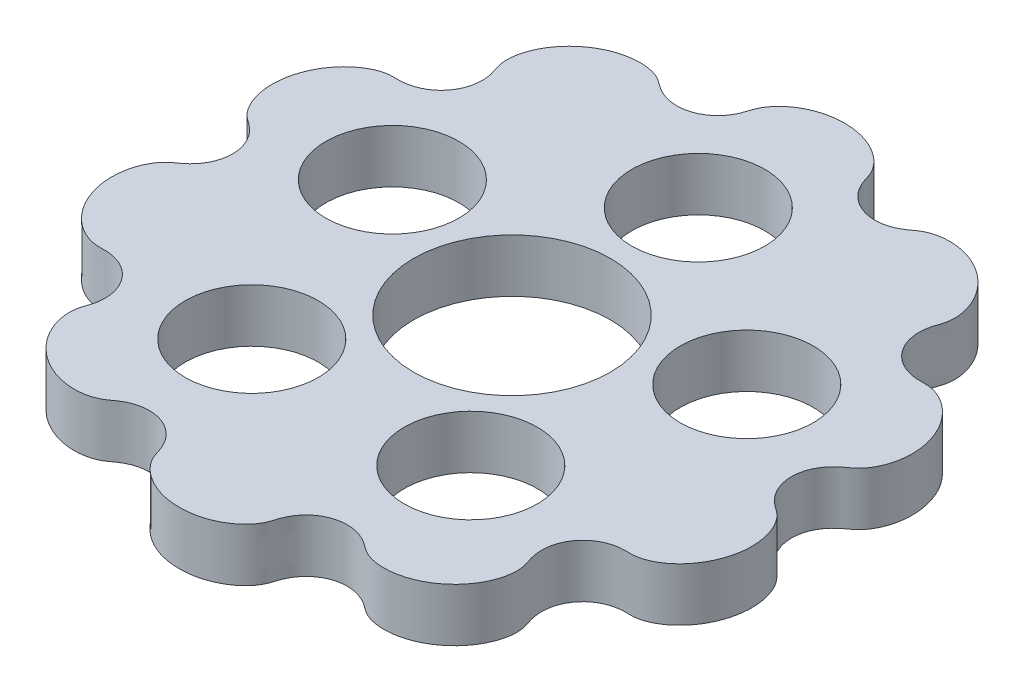
from build123d import *

# Parameters (mm, degrees)
BOSS_EXTRUDE1_DEPTH = 10
SKETCH2_R           = 18.5
CUT_EXTRUDE1_DEPTH  = 10
SKETCH3_R           = 12.5
CUT_EXTRUDE2_DEPTH  = 10


with BuildPart() as part:
    # Sketch1 → Boss-Extrude1 (new body)
    with BuildSketch(Plane(origin=(0, 0, 0), x_dir=(1, 0, 0), z_dir=(0, 1, 0))):
        with BuildLine():
            Line((52.500112047, 0.041499268), (52.5, 0))
            add(Edge.make_bspline(
                [(52.5, 0), (52.5, -0.040775104), (52.500774613, -0.123087013), (52.504260374, -0.275203234), (52.513552623, -0.474859373), (52.530965766, -0.708851543), (52.561121002, -0.98870434), (52.609439336, -1.315624541), (52.682361725, -1.681556002), (52.79478949, -2.132352063), (53.017440279, -2.830912765), (53.427825855, -3.753064751), (54.070723482, -4.744647846), (54.830098124, -5.57543267), (55.503742099, -6.156986939), (56.012379262, -6.538989783), (56.410817284, -6.8180386), (56.792354666, -7.089426209), (57.141972837, -7.372775575), (57.520705307, -7.729900694), (57.915655074, -8.169788958), (58.493265667, -8.937596576), (59.088332831, -9.999121058), (59.60031922, -11.302344039), (60.049283036, -13.196982519), (60.21435633, -15.393229318), (59.936875398, -17.972579969), (59.123851439, -20.445560196), (58.061489591, -22.416056329), (56.93724145, -23.918460352), (55.904987118, -25.008602876), (54.669536216, -26.028627864), (53.297351575, -26.859933117), (52.038099601, -27.360838699), (50.961670842, -27.590008876), (50.217402108, -27.645168686), (49.722891169, -27.643633637), (49.243636807, -27.633529208), (48.778988932, -27.638419544), (48.221278005, -27.666683373), (47.41280666, -27.758419009), (46.36184117, -27.997640241), (45.106586398, -28.507483026), (43.830924892, -29.341955818), (42.742085128, -30.41036414), (41.886481884, -31.671659022), (41.301364772, -33.057237307), (40.99581945, -34.504112382), (40.966298719, -35.851798689), (41.119084615, -36.941869369), (41.33280208, -37.775207751), (41.516924768, -38.34844275), (41.666645545, -38.77904393), (41.800656721, -39.192740913), (41.903341656, -39.593554607), (41.993133909, -40.078929424), (42.052216808, -40.649589301), (42.065252977, -41.370183161), (41.996014835, -42.235021446), (41.811794729, -43.268256263), (41.463289857, -44.44971281), (40.795122932, -46.026243031), (39.631588245, -47.891122448), (37.881243888, -49.810401445), (35.757139486, -51.328799151), (33.722804169, -52.293622479), (31.909539427, -52.841120104), (30.417481353, -53.106645377), (28.866576826, -53.18693875), (27.506439201, -53.066248838), (26.359550674, -52.806209521), (25.481229259, -52.483830009), (24.949497308, -52.22752035), (24.545269464, -51.987858636), (24.197836887, -51.752478957), (23.91719106, -51.543602368), (23.638072028, -51.333216659), (23.232003211, -51.041007331), (22.747291626, -50.720207013), (21.966309113, -50.282205151), (20.8507479, -49.837358278), (19.511516152, -49.545007241), (17.973118181, -49.515911952), (16.464788325, -49.789598147), (15.048825761, -50.353729824), (13.794685705, -51.165870404), (12.736744373, -52.179362518), (11.958645939, -53.262101177), (11.470580022, -54.23549557), (11.172776949, -55.033617241), (10.994183181, -55.601171139), (10.863038629, -56.033024877), (10.719891261, -56.439711402), (10.557601138, -56.816955145), (10.335220959, -57.252767932), (10.039175881, -57.737601345), (9.618795925, -58.314311024), (9.049448054, -58.957537258), (8.02602458, -59.914761677), (6.414925386, -61.01402137), (4.18541385, -61.99047672), (1.339206638, -62.560334562), (-1.555531464, -62.53729671), (-4.027053866, -62.002092903), (-6.020498101, -61.177979995), (-7.433612118, -60.318248685), (-8.349845643, -59.613363928), (-9.059073439, -58.943021869), (-9.588949014, -58.348313406), (-10.039829693, -57.741557787), (-10.365276791, -57.206581724), (-10.601994867, -56.725204004), (-10.784693807, -56.266063365), (-10.903590116, -55.900984278), (-11.008873941, -55.553724102), (-11.134049094, -55.16276416), (-11.269248876, -54.774995851), (-11.523977597, -54.135327447), (-11.97036594, -53.259233437), (-12.664097567, -52.265735325), (-13.688242337, -51.253082849), (-14.898427531, -50.438148562), (-16.281880822, -49.846825376), (-17.790043805, -49.530016792), (-19.353945001, -49.522503129), (-20.901974601, -49.835627594), (-22.114833491, -50.341973603), (-22.958543667, -50.848586676), (-23.503901488, -51.235222612), (-23.850472854, -51.492291991), (-24.137313704, -51.709093473), (-24.432197812, -51.915271617), (-24.84493276, -52.167528227), (-25.321855844, -52.412656958), (-25.96481748, -52.671655444), (-26.781628931, -52.905200029), (-27.808201786, -53.093827833), (-29.044525926, -53.179007384), (-30.44463053, -53.105993185), (-31.982839615, -52.825723181), (-33.849256231, -52.246902431), (-35.958134282, -51.21612146), (-37.845089492, -49.811408736), (-39.434207075, -48.089368266), (-40.517522955, -46.475169127), (-41.221930423, -45.088252289), (-41.676779129, -43.804668375), (-41.933312299, -42.66675977), (-42.045425372, -41.702444398), (-42.067377697, -40.925961222), (-42.021074543, -40.264759033), (-41.932238905, -39.723786783), (-41.810407763, -39.224890497), (-41.689047079, -38.844186817), (-41.557634437, -38.467204533), (-41.40843966, -38.011933626), (-41.263776073, -37.51715494), (-41.122558611, -36.901278864), (-41.018323259, -36.161630315), (-40.983791966, -35.380565994), (-41.035800805, -34.417307382), (-41.250683665, -33.265400151), (-41.724972968, -31.974622959), (-42.561003579, -30.626764416), (-43.666232311, -29.470591914), (-44.9678346, -28.575717503), (-46.406824522, -27.966624741), (-47.678381182, -27.698584729), (-48.721400157, -27.629657861), (-49.455398293, -27.637667477), (-49.883858288, -27.645357105), (-50.312272667, -27.637708005), (-50.984181143, -27.586491548), (-52.020178925, -27.367063728), (-53.299737285, -26.858300232), (-54.683978708, -26.018809413), (-55.929162606, -24.989246611), (-56.988984387, -23.860138009), (-58.136648947, -22.301668216), (-59.199039353, -20.273838696), (-59.986881871, -17.748693553), (-60.21964241, -15.133491801), (-60.009115811, -12.931924961), (-59.531985693, -11.105818685), (-59.020540349, -9.869815751), (-58.444529768, -8.870463614), (-57.911905451, -8.16589022), (-57.533893822, -7.745175041), (-57.186010877, -7.413925705), (-56.882639117, -7.160406886), (-56.540492932, -6.908118175), (-56.167029965, -6.648675798), (-55.670549933, -6.288310206), (-54.992871461, -5.730778683), (-54.210261673, -4.921559825), (-53.431761371, -3.793482861), (-52.830005835, -2.428848247), (-52.50018024, -0.966894579), (-52.45710778, 0.55217178), (-52.715346679, 2.061038448), (-53.262745959, 3.483189007), (-54.003522836, 4.655570316), (-54.738842919, 5.480176022), (-55.363609549, 6.038854723), (-55.822698494, 6.398885917), (-56.199652301, 6.671642922), (-56.580876946, 6.936217924), (-56.952359332, 7.21299597), (-57.356964995, 7.565455772), (-57.779033807, 8.005594079), (-58.333004427, 8.703310537), (-58.930858079, 9.690000179), (-59.468395563, 10.920525875), (-59.88098257, 12.393861768), (-60.104110317, 13.886861601), (-60.162929299, 15.77263982), (-59.894351202, 18.031901967), (-59.222128747, 20.215221461), (-58.171721151, 22.239421873), (-57.055582562, 23.777128021), (-56.02560654, 24.895455314), (-54.800789785, 25.934015099), (-53.599166224, 26.686592588), (-52.479058719, 27.188073207), (-51.541410433, 27.463768014), (-50.907996169, 27.58623828), (-50.323052413, 27.642444042), (-49.793368704, 27.645454859), (-49.161420973, 27.630897707), (-48.425638713, 27.643923436), (-47.452112168, 27.743202219), (-46.253392235, 28.031088734), (-44.966985481, 28.579010116), (-43.681931524, 29.459496211), (-42.581632308, 30.601244304), (-41.741453991, 31.940574772), (-41.260247486, 33.231303487), (-41.039889407, 34.384774707), (-40.983925413, 35.349776914), (-41.015606549, 36.13235386), (-41.117442143, 36.873430873), (-41.256894642, 37.490405082), (-41.40044371, 37.986071754), (-41.549005454, 38.442040607), (-41.680489719, 38.81941179), (-41.803238659, 39.200044109), (-41.927309345, 39.698951407), (-42.018383692, 40.240195152), (-42.066935039, 40.902074767), (-42.047115021, 41.679637388), (-41.959147144, 42.452360499), (-41.80983027, 43.215616682), (-41.552975722, 44.153132728), (-41.141175226, 45.245572709), (-40.525557083, 46.461715744), (-39.4424436, 48.079451974), (-37.85404638, 49.803595139), (-35.968278488, 51.209686131), (-33.861529251, 52.241649801), (-31.998674239, 52.821691844), (-30.46337711, 53.103608918), (-28.837187897, 53.191254625), (-27.407614237, 53.056444511), (-26.201202795, 52.76438447), (-25.279351434, 52.396703468), (-24.677788171, 52.080354109), (-24.21752736, 51.769607541), (-23.873955873, 51.509928533), (-23.528223416, 51.252981421), (-22.984627988, 50.865507158), (-22.144104002, 50.356693714), (-20.935439425, 49.846213318), (-19.3913041, 49.526456256), (-17.829254478, 49.526135593), (-16.319695021, 49.835022896), (-14.932096914, 50.419729412), (-13.715938616, 51.230198589), (-12.686115318, 52.239564641), (-11.987509156, 53.231250656), (-11.537238791, 54.106589689), (-11.280154609, 54.74590305), (-11.143490652, 55.134555258), (-11.017251726, 55.52655965), (-10.911617075, 55.874694641), (-10.793605506, 56.240873359), (-10.61264544, 56.701454513), (-10.377657722, 57.184306701), (-10.05367296, 57.721089897), (-9.603957867, 58.330025828), (-9.074733276, 58.927008479), (-8.365866072, 59.599921208), (-7.44951617, 60.307550778), (-6.035632673, 61.170720627), (-4.04018557, 61.998420975), (-1.579089164, 62.533605592), (1.291815666, 62.561795887), (3.752258944, 62.079889071), (5.745965785, 61.307921444), (7.199793361, 60.474219704), (8.183788526, 59.75526832), (9.08534121, 58.934715248), (9.77298311, 58.141310376), (10.26637145, 57.40134047), (10.590569673, 56.751733025), (10.782976111, 56.272926309), (10.929805218, 55.818826792), (11.082053727, 55.310602543), (11.272919801, 54.75795526), (11.507073298, 54.188205456), (11.795151363, 53.608443196), (12.233667119, 52.879331142), (12.884248795, 52.038068903), (13.796070035, 51.167665373), (15.032902903, 50.363317809), (16.441314941, 49.796050701), (17.946742147, 49.517551845), (19.490594486, 49.54245585), (20.988089237, 49.865761077), (22.166965774, 50.368484275), (23.002510374, 50.877366694), (23.541879966, 51.263001962), (23.883796536, 51.517387838), (24.223900371, 51.774078316), (24.677797346, 52.079837114), (25.268883718, 52.391266914), (26.172078382, 52.754113463), (27.352445592, 53.045797013), (28.752366956, 53.187326819), (30.346839996, 53.115359385), (31.854236365, 52.854985782), (33.686501376, 52.309236301), (35.734839756, 51.343386182), (37.867854874, 49.822880178), (39.622725085, 47.902057151), (40.786724772, 46.041502486), (41.456361051, 44.468438722), (41.80657843, 43.289417372), (41.99284709, 42.258198954), (42.064280359, 41.394940087), (42.053563066, 40.675459718), (41.996733194, 40.105472702), (41.909150659, 39.620367743), (41.808437593, 39.21948535), (41.675961045, 38.805916273), (41.526336774, 38.376128681), (41.341357817, 37.804547222), (41.125224382, 36.973353631), (40.968386981, 35.885816058), (40.991909962, 34.540385624), (41.290083968, 33.094121724), (41.86974643, 31.701518261), (42.727245107, 30.42570814), (43.826776707, 29.342697928), (45.124572371, 28.495874409), (46.306742469, 28.021705499), (47.276769412, 27.789943287), (48.00922742, 27.689721552), (48.479227355, 27.650650673), (48.950392436, 27.634492295), (49.421529354, 27.636348205), (49.892283913, 27.646657347), (50.363277789, 27.63803436), (50.905300024, 27.585271394), (51.51251131, 27.470335592), (52.377287443, 27.221336204), (53.447566574, 26.760818113), (54.611545034, 26.064224331), (56.112483168, 24.854029299), (57.637143252, 23.134068615), (58.989135241, 20.848764181), (59.932831288, 17.996368795), (60.213669841, 15.407261933), (60.051536889, 13.214223886), (59.606259706, 11.321795444), (59.097629324, 10.019537514), (58.506049745, 8.958102514), (57.931698947, 8.18961796), (57.539001836, 7.748957275), (57.162482014, 7.390873577), (56.814939151, 7.106469911), (56.434736206, 6.834545529), (56.036508617, 6.556332642), (55.52738295, 6.176006208), (54.85281643, 5.59762287), (54.214751532, 4.905088715), (53.646797062, 4.091977331), (53.263477344, 3.366666269), (53.046152845, 2.864253535), (52.891115189, 2.433101978), (52.782934872, 2.08053528), (52.691189954, 1.720373118), (52.616465578, 1.355469061), (52.566473841, 1.029116993), (52.534855461, 0.749611282), (52.516206484, 0.515950905), (52.505852491, 0.316761484), (52.501548502, 0.164275854), (52.500332064, 0.082243276), (52.500112047, 0.041499268)],
                knots=[0.06845127, 0.06845127, 0.06845127, 0.06845127, 0.06845127, 0.068823272, 0.069195273, 0.069567274, 0.069939276, 0.070683278, 0.071427281, 0.072154812, 0.072882343, 0.074337405, 0.07719601, 0.080073521, 0.082134054, 0.08316432, 0.084194587, 0.085079604, 0.085964622, 0.08684964, 0.087734657, 0.089174128, 0.090613599, 0.094403019, 0.097278761, 0.100154504, 0.105904344, 0.111655069, 0.117552368, 0.1205004, 0.123448432, 0.126396991, 0.129345549, 0.133079313, 0.136027875, 0.13700093, 0.137973986, 0.138947041, 0.139920097, 0.140775668, 0.141631239, 0.143342381, 0.146320718, 0.149231392, 0.152233675, 0.15526906, 0.158251886, 0.16115228, 0.164001532, 0.166843446, 0.168806033, 0.169787326, 0.17076862, 0.171582383, 0.172396147, 0.17320991, 0.174023674, 0.175465733, 0.176907793, 0.178875994, 0.180844196, 0.183714604, 0.186585013, 0.192323159, 0.198062711, 0.204015066, 0.206990805, 0.209966544, 0.212942593, 0.215918641, 0.219183194, 0.220677276, 0.222171358, 0.223272511, 0.223823088, 0.224373664, 0.225474818, 0.226025394, 0.226575971, 0.228312193, 0.230048414, 0.233063602, 0.235996078, 0.239037647, 0.242085279, 0.245051887, 0.247917801, 0.250729216, 0.253554306, 0.255492533, 0.256461646, 0.25743076, 0.258238474, 0.259046189, 0.259853904, 0.260661618, 0.26208787, 0.263514123, 0.265464894, 0.267415665, 0.273101354, 0.278785369, 0.284470299, 0.290103678, 0.295735944, 0.298553065, 0.301370187, 0.303094953, 0.304819719, 0.306226752, 0.307633785, 0.309039221, 0.30974194, 0.310444658, 0.311522042, 0.312060734, 0.312599426, 0.31367681, 0.314754194, 0.317479171, 0.320323626, 0.323166882, 0.326028942, 0.328898819, 0.332098663, 0.335219163, 0.338253411, 0.341251382, 0.342383822, 0.342950043, 0.343516263, 0.344648704, 0.345214925, 0.345781145, 0.347323091, 0.348865036, 0.350661989, 0.352458943, 0.355528451, 0.358597959, 0.361667797, 0.364737635, 0.370878007, 0.376986352, 0.380040162, 0.383093972, 0.386147981, 0.38920199, 0.390729266, 0.392256542, 0.393782993, 0.395309444, 0.39593816, 0.396566876, 0.397824309, 0.398453025, 0.399081741, 0.400339174, 0.401881099, 0.403423024, 0.404954093, 0.406485162, 0.409463946, 0.412614603, 0.415707767, 0.418884467, 0.4219674, 0.424963071, 0.427931545, 0.429055978, 0.430180411, 0.430742628, 0.431304844, 0.432429277, 0.435479881, 0.439041038, 0.442082184, 0.44512333, 0.44816352, 0.451203711, 0.45728559, 0.46305952, 0.468832192, 0.471719554, 0.474606917, 0.477880013, 0.479326404, 0.480772795, 0.481550431, 0.482328068, 0.483105704, 0.483883341, 0.484896159, 0.485908976, 0.487934612, 0.49078543, 0.493726769, 0.49663789, 0.499605508, 0.502511284, 0.505616872, 0.508611335, 0.511523531, 0.513363684, 0.51428376, 0.515203837, 0.516115167, 0.517026498, 0.517937828, 0.518849159, 0.520335083, 0.521821008, 0.524940044, 0.527904552, 0.530869061, 0.533833005, 0.53679695, 0.542726335, 0.548697614, 0.551682524, 0.554667433, 0.557653568, 0.560639704, 0.564291067, 0.565785387, 0.567279707, 0.568321479, 0.569363251, 0.570405024, 0.571446796, 0.573299705, 0.575152614, 0.578095141, 0.581116502, 0.58423972, 0.587334492, 0.590491619, 0.593476477, 0.595011269, 0.596546061, 0.598089729, 0.599633398, 0.600892048, 0.601521373, 0.602150698, 0.603409348, 0.604038673, 0.604667998, 0.606196302, 0.607724606, 0.609254007, 0.610783408, 0.612312631, 0.613841854, 0.616900299, 0.619958524, 0.623016749, 0.629133832, 0.635264708, 0.638329743, 0.641394778, 0.644459353, 0.647523928, 0.651113076, 0.652652789, 0.654192502, 0.655322957, 0.656453413, 0.657018641, 0.657583869, 0.658714324, 0.661708929, 0.664737241, 0.667851628, 0.671047845, 0.673919086, 0.676787714, 0.679636085, 0.682486592, 0.685207159, 0.686287989, 0.68736882, 0.687909236, 0.688449651, 0.689530482, 0.690233726, 0.69093697, 0.692343457, 0.693752743, 0.69516203, 0.696889481, 0.698616933, 0.701438229, 0.704259526, 0.709899918, 0.715541538, 0.721126111, 0.726710151, 0.729502368, 0.732294586, 0.734290209, 0.736285833, 0.739083712, 0.740538691, 0.741266181, 0.74199367, 0.743143851, 0.744294032, 0.745444213, 0.746594394, 0.74799041, 0.749386427, 0.752134605, 0.754942324, 0.757860682, 0.760934045, 0.764010929, 0.766913817, 0.769939, 0.772922153, 0.774040585, 0.774599801, 0.775159017, 0.776277448, 0.77739588, 0.778902389, 0.780408899, 0.783926778, 0.786931093, 0.789935409, 0.792938496, 0.795941582, 0.801949213, 0.807679923, 0.813409325, 0.816275311, 0.819141297, 0.821106721, 0.823072145, 0.824511541, 0.825950937, 0.82676387, 0.827576803, 0.828389735, 0.829202668, 0.830181625, 0.831160582, 0.833118497, 0.835958323, 0.838801693, 0.841696397, 0.844676707, 0.84776064, 0.850823682, 0.853764411, 0.85679873, 0.857726636, 0.858654542, 0.859582448, 0.860510354, 0.861436959, 0.862363564, 0.863290169, 0.864216774, 0.865719604, 0.867222434, 0.870363348, 0.873362207, 0.876361065, 0.882358431, 0.888356938, 0.894098863, 0.899840077, 0.902711294, 0.905582512, 0.909366312, 0.910804045, 0.912241777, 0.913124921, 0.914008066, 0.91489121, 0.915774354, 0.916803936, 0.917833519, 0.919892684, 0.922762104, 0.92418929, 0.925616475, 0.92634252, 0.927068565, 0.927794611, 0.928520656, 0.929264102, 0.930007548, 0.930379271, 0.930750994, 0.931122717, 0.93149444, 0.93149444, 0.93149444, 0.93149444, 0.93149444], degree=4))
        make_face()
    extrude(amount=BOSS_EXTRUDE1_DEPTH)

    # Sketch2 → Cut-Extrude1 (cut)
    with BuildSketch(Plane(origin=(0, 10, 0), x_dir=(1, 0, 0), z_dir=(0, 1, 0))):
        with Locations(Location((0, 0, 0), (0, 0, 270))):
            Circle(SKETCH2_R)
    extrude(amount=-CUT_EXTRUDE1_DEPTH, mode=Mode.SUBTRACT)

    # Sketch3 → Cut-Extrude2 (cut)
    with BuildSketch(Plane(origin=(0, 10, 0), x_dir=(1, 0, 0), z_dir=(0, 1, 0))):
        with Locations(Location((0, 35, 0), (0, 0, 270))):
            Circle(SKETCH3_R)
        with Locations(Location((33.28697807, 10.815594803, 0), (0, 0, 270))):
            Circle(SKETCH3_R)
        with Locations(Location((20.57248383, -28.315594803, 0), (0, 0, 270))):
            Circle(SKETCH3_R)
        with Locations(Location((-20.57248383, -28.315594803, 0), (0, 0, 270))):
            Circle(SKETCH3_R)
        with Locations(Location((-33.28697807, 10.815594803, 0), (0, 0, 270))):
            Circle(SKETCH3_R)
    extrude(amount=-CUT_EXTRUDE2_DEPTH, mode=Mode.SUBTRACT)


solid = part.part
